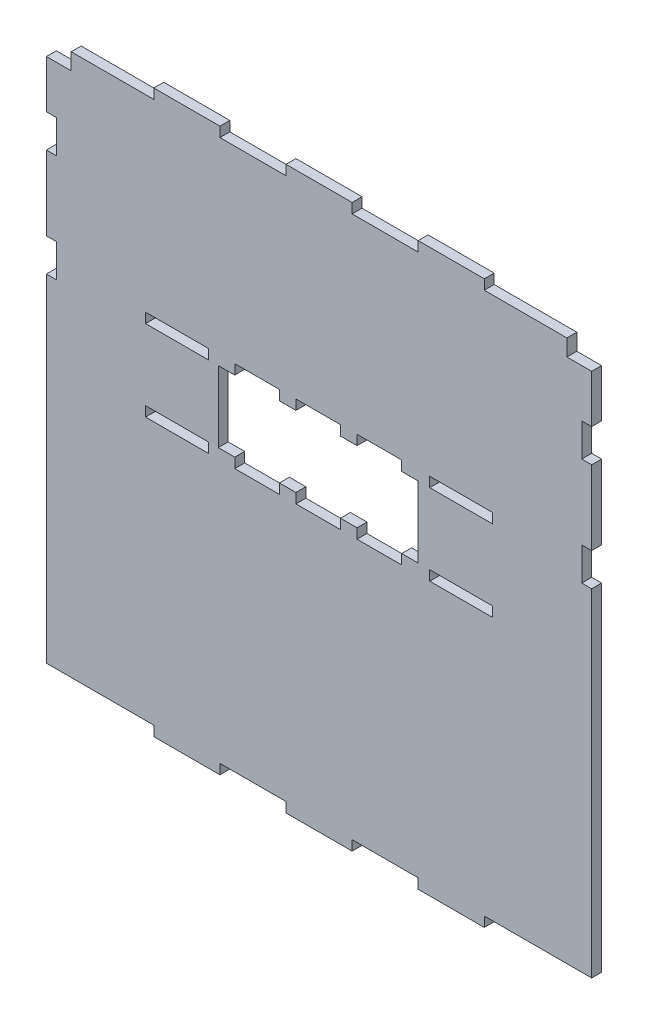
from build123d import *

# Parameters (mm, degrees)
ESQUISSE2_W                            = 330
ESQUISSE2_H                            = 340
BOSS_EXTRU_1_DEPTH                     = 6
ESQUISSE4_W                            = 65
ESQUISSE4_H                            = 6
ESQUISSE4_W_2                          = 40
ESQUISSE4_W_3                          = 6
ESQUISSE4_H_2                          = 20
ENL_V_MAT_ENCOCHE_BORD_DEPTH           = 474.852297662
ESQUISSE5_W                            = 38
ESQUISSE5_H                            = 6
ESQUISSE5_W_2                          = 15
ESQUISSE5_H_2                          = 10
ENL_V_MAT_ENCOCHE_TAGE_ROULETTES_DEPTH = 474.852297662
ENL_V_MAT_EXTRU_2_DEPTH                = 6


with BuildPart() as part:
    # Esquisse2 → Boss.-Extru.1 (new body)
    with BuildSketch(Plane.XY):
        with Locations((-165, -170)):
            Rectangle(ESQUISSE2_W, ESQUISSE2_H)
    extrude(amount=BOSS_EXTRU_1_DEPTH)

    # Esquisse4 → Enlèv. mat encoche bord (cut, through all)
    with BuildSketch(Plane(origin=(0, 0, 0), x_dir=(-1, 0, 0), z_dir=(0, 0, -1))):
        with Locations((297.5, -3)):
            Rectangle(ESQUISSE4_W, ESQUISSE4_H)
        with Locations((205, -3)):
            Rectangle(ESQUISSE4_W_2, ESQUISSE4_H)
        with Locations((125, -3)):
            Rectangle(ESQUISSE4_W_2, ESQUISSE4_H)
        with Locations((32.5, -3)):
            Rectangle(ESQUISSE4_W, ESQUISSE4_H)
        with Locations((327, -55)):
            Rectangle(ESQUISSE4_W_3, ESQUISSE4_H_2)
        with Locations((3, -55)):
            Rectangle(ESQUISSE4_W_3, ESQUISSE4_H_2)
        with Locations((297.5, -337)):
            Rectangle(ESQUISSE4_W, ESQUISSE4_H)
        with Locations((205, -337)):
            Rectangle(ESQUISSE4_W_2, ESQUISSE4_H)
        with Locations((125, -337)):
            Rectangle(ESQUISSE4_W_2, ESQUISSE4_H)
        with Locations((32.5, -337)):
            Rectangle(ESQUISSE4_W, ESQUISSE4_H)
        with Locations((327, -120)):
            Rectangle(ESQUISSE4_W_3, ESQUISSE4_H_2)
        with Locations((3, -120)):
            Rectangle(ESQUISSE4_W_3, ESQUISSE4_H_2)
    extrude(amount=-ENL_V_MAT_ENCOCHE_BORD_DEPTH, mode=Mode.SUBTRACT)

    # Esquisse5 → Enlèv. mat encoche étage + roulettes (cut, through all)
    with BuildSketch(Plane(origin=(0, 0, 0), x_dir=(-1, 0, 0), z_dir=(0, 0, -1))):
        with Locations((251, -172)):
            Rectangle(ESQUISSE5_W, ESQUISSE5_H)
        with Locations((79, -172)):
            Rectangle(ESQUISSE5_W, ESQUISSE5_H)
        with Locations((322.5, -11)):
            Rectangle(ESQUISSE5_W_2, ESQUISSE5_H_2)
        with Locations((7.5, -11)):
            Rectangle(ESQUISSE5_W_2, ESQUISSE5_H_2)
        with Locations((251, -123)):
            Rectangle(ESQUISSE5_W, ESQUISSE5_H)
        with Locations((79, -123)):
            Rectangle(ESQUISSE5_W, ESQUISSE5_H)
    extrude(amount=-ENL_V_MAT_ENCOCHE_TAGE_ROULETTES_DEPTH, mode=Mode.SUBTRACT)

    # Esquisse6 → Enlèv. mat.-Extru.2 (cut)
    with BuildSketch(Plane(origin=(0, 0, 0), x_dir=(-1, 0, 0), z_dir=(0, 0, -1))):
        Polygon((226, -169), (216, -169), (216, -175), (189, -175), (189, -169), (179, -169), (179, -175), (152, -175), (152, -169), (142, -169), (142, -175), (115, -175), (115, -169), (105, -169), (105, -126), (115, -126), (115, -120), (142, -120), (142, -126), (152, -126), (152, -120), (179, -120), (179, -126), (189, -126), (189, -120), (216, -120), (216, -126), (226, -126), align=None)
    extrude(amount=-ENL_V_MAT_EXTRU_2_DEPTH, mode=Mode.SUBTRACT)


solid = part.part
